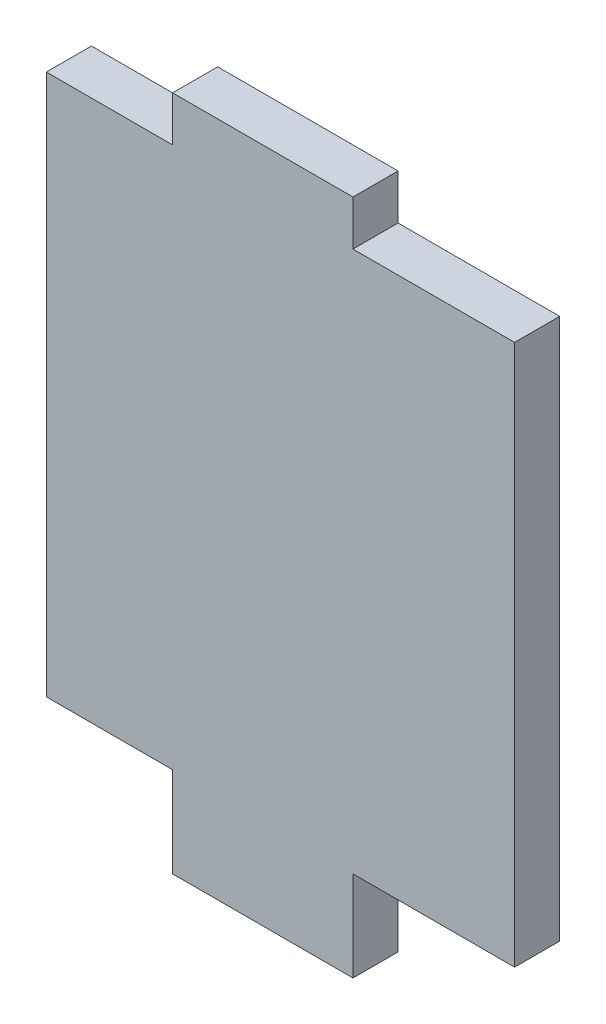
from build123d import *

# Parameters (mm, degrees)
BOSS_EXTRUDE1_DEPTH = 2.5


with BuildPart() as part:
    # Sketch1 → Boss-Extrude1 (new body)
    with BuildSketch(Plane.XY):
        Polygon((-12.980754985, 16.25), (-5.980754985, 16.25), (-5.980754985, 18.75), (4.019245015, 18.75), (4.019245015, 16.25), (12.980754985, 16.25), (12.980754985, -13.75), (4.019245015, -13.75), (4.019245015, -18.75), (-5.980754985, -18.75), (-5.980754985, -13.75), (-12.980754985, -13.75), align=None)
    extrude(amount=BOSS_EXTRUDE1_DEPTH)


solid = part.part
